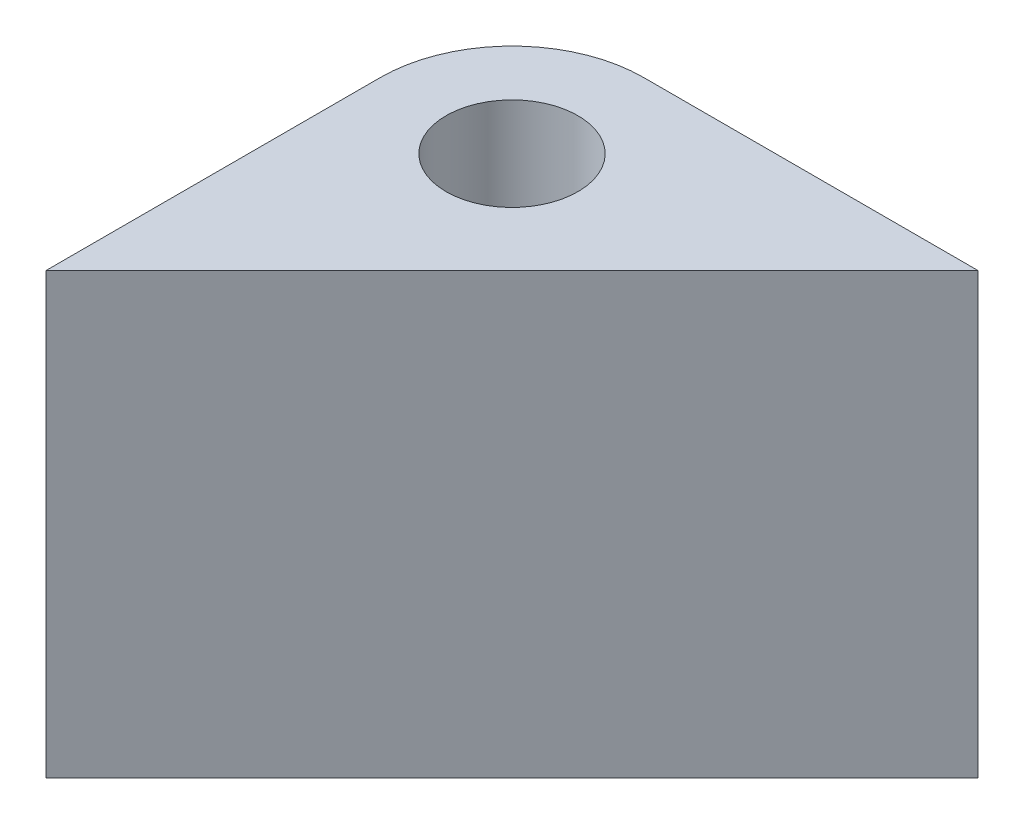
from build123d import *

# Parameters (mm, degrees)
SKETCH1_R           = 1.5
BOSS_EXTRUDE1_DEPTH = 10


with BuildPart() as part:
    # Sketch1 → Boss-Extrude1 (new body)
    with BuildSketch(Plane(origin=(0, 0, 0), x_dir=(1, 0, 0), z_dir=(0, 1, 0))):
        with BuildLine():
            Line((7.606601718, 3), (0, 3))
            ThreePointArc((0, 3), (-2.121320344, 2.121320344), (-3, 0))
            Line((-3, 0), (-3, -7.606601718))
            Line((-3, -7.606601718), (7.606601718, 3))
        make_face()
        with Locations(Location((0, 0, 0), (0, 0, 270))):
            Circle(SKETCH1_R, mode=Mode.SUBTRACT)
    extrude(amount=BOSS_EXTRUDE1_DEPTH)


solid = part.part
